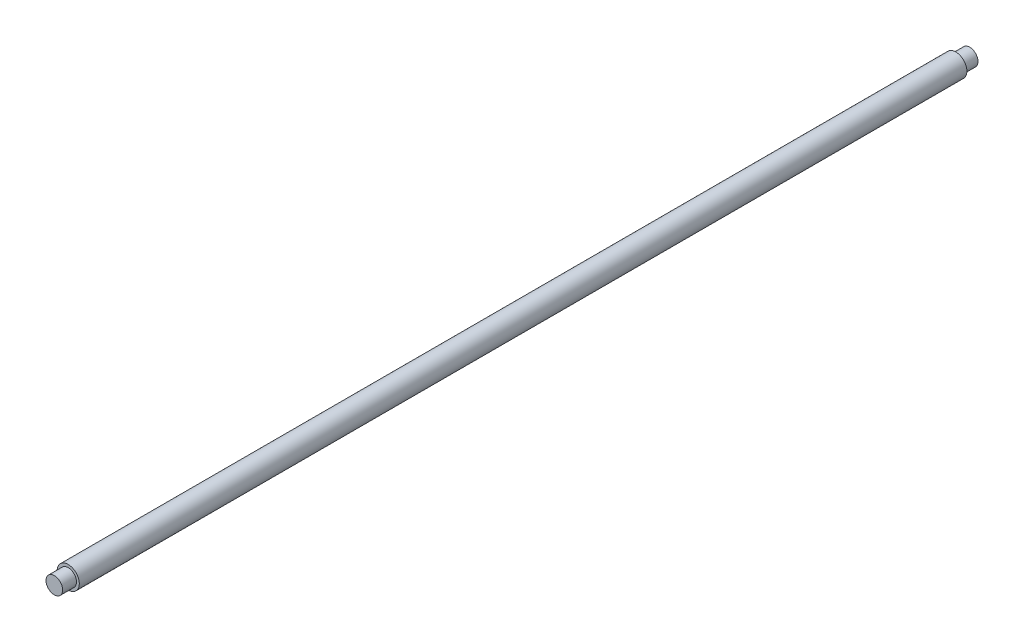
from build123d import *

# Parameters (mm, degrees)
SKETCH_1_R      = 3
EXTRUDE_1_DEPTH = 330
SKETCH_2_R      = 4
EXTRUDE_2_DEPTH = 320


with BuildPart() as part:
    # 스케치1 → 보스-돌출1 (new body)
    with BuildSketch(Plane.XY):
        Circle(SKETCH_1_R)
    extrude(amount=EXTRUDE_1_DEPTH)

    # 스케치2 → 보스-돌출2 (add)
    with BuildSketch(Plane(origin=(0, 0, 5), x_dir=(-1, 0, 0), z_dir=(0, 0, -1))):
        Circle(SKETCH_2_R)
    extrude(amount=-EXTRUDE_2_DEPTH)


solid = part.part
